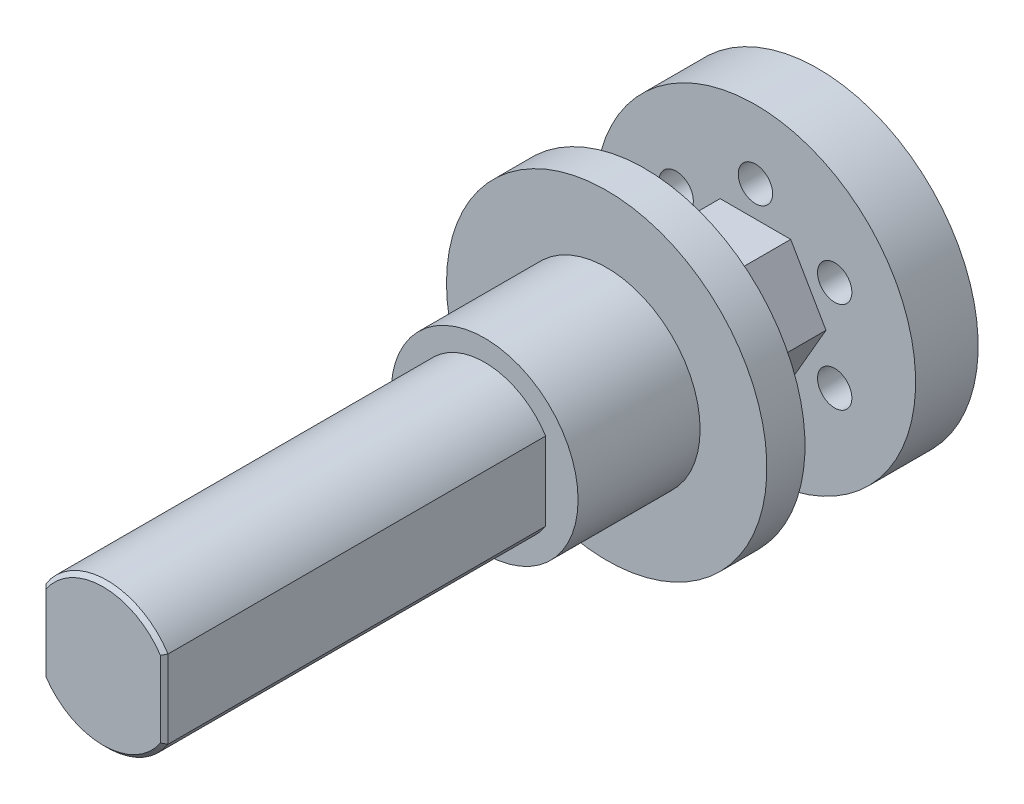
from build123d import *

# Parameters (mm, degrees)
SKETCH_1_R            = 9.25
EXTRUDE_1_DEPTH       = 89.5
SKETCH_4_R            = 12.25
EXTRUDE_2_DEPTH       = 16
SKETCH_5_R            = 21
EXTRUDE_3_DEPTH       = 5
EXTRUDE_4_DEPTH       = 4.2
EXTRUDE_4_DEPTH_BACK  = 4
SKETCH_6_R            = 21
SKETCH_6_R_2          = 2.25
SKETCH_7_R            = 20
CUT_EXTRUDE_1_DEPTH   = 2
SKETCH_8_OUTSIDE_W    = 66.188
SKETCH_8_OUTSIDE_H    = 66.188
CUT_EXTRUDE_4_DEPTH   = 14.5
SKETCH_11_R           = 9.5
EXTRUDE_5_DEPTH       = 50
SKETCH_13_W           = 10
SKETCH_13_H           = 10.246950766
CUT_EXTRUDE_1_2_DEPTH = 50
CHAMFER_1_SIZE        = 0.5


with BuildPart() as part:
    # 草图1 → 凸台-拉伸1 (new body)
    with BuildSketch(Plane.XY):
        with Locations(Location((0, 0, 0), (0, 0, 180))):
            Circle(SKETCH_1_R)
    extrude(amount=EXTRUDE_1_DEPTH)

    # 草图4 → 凸台-拉伸2 (add)
    with BuildSketch(Plane.XY.offset(39.5)):
        Circle(SKETCH_4_R)
    extrude(amount=-EXTRUDE_2_DEPTH)

    # 草图5 → 凸台-拉伸3 (add)
    with BuildSketch(Plane(origin=(0, 0, 23.5), x_dir=(-1, 0, 0), z_dir=(0, 0, -1))):
        Circle(SKETCH_5_R)
    extrude(amount=EXTRUDE_3_DEPTH)

    # 草图6 → 凸台-拉伸4 (add, two sides: drawn at the far end of the back side and taken through both)
    with BuildSketch(Plane(origin=(0, 0, 0), x_dir=(-1, 0, 0), z_dir=(0, 0, -1)).offset(-EXTRUDE_4_DEPTH_BACK)):
        Circle(SKETCH_6_R)
        with Locations((0, 12)):
            Circle(SKETCH_6_R_2, mode=Mode.SUBTRACT)
        with Locations((10.392304845, 6)):
            Circle(SKETCH_6_R_2, mode=Mode.SUBTRACT)
        with Locations((10.392304845, -6)):
            Circle(SKETCH_6_R_2, mode=Mode.SUBTRACT)
        with Locations((0, -12)):
            Circle(SKETCH_6_R_2, mode=Mode.SUBTRACT)
        with Locations((-10.392304845, -6)):
            Circle(SKETCH_6_R_2, mode=Mode.SUBTRACT)
        with Locations((-10.392304845, 6)):
            Circle(SKETCH_6_R_2, mode=Mode.SUBTRACT)
    extrude(amount=EXTRUDE_4_DEPTH + EXTRUDE_4_DEPTH_BACK)

    # 草图7 → Cut-Extrude 1 (cut)
    with BuildSketch(Plane(origin=(0, 0, -4.2), x_dir=(-1, 0, 0), z_dir=(0, 0, -1))):
        Circle(SKETCH_7_R)
    extrude(amount=-CUT_EXTRUDE_1_DEPTH, mode=Mode.SUBTRACT)

    # 草图8 outside → 切除-拉伸4 (cut)
    with BuildSketch(Plane(origin=(0, 0, 18.5), x_dir=(-1, 0, 0), z_dir=(0, 0, -1))):
        Rectangle(SKETCH_8_OUTSIDE_W, SKETCH_8_OUTSIDE_H)
        Polygon((-9.25, 0), (-4.625, -8.010734985), (4.625, -8.010734985), (9.25, 0), (4.625, 8.010734985), (-4.625, 8.010734985), align=None, mode=Mode.SUBTRACT)
    extrude(amount=CUT_EXTRUDE_4_DEPTH, mode=Mode.SUBTRACT)

    # 草图11 → 凸台-拉伸5 (add)
    with BuildSketch(Plane.XY.offset(39.5)):
        Circle(SKETCH_11_R)
    extrude(amount=EXTRUDE_5_DEPTH)

    # 草图13 → Cut-Extrude 1 2 (cut)
    with BuildSketch(Plane.XY.offset(89.5)):
        with Locations((-13, 0)):
            Rectangle(SKETCH_13_W, SKETCH_13_H)
        with Locations((13, 0)):
            Rectangle(SKETCH_13_W, SKETCH_13_H)
    extrude(amount=-CUT_EXTRUDE_1_2_DEPTH, mode=Mode.SUBTRACT)

    # 倒角1
    chamfer_1_edges = [part.edges().sort_by_distance(p)[0] for p in [
        (8, 0, 89.5),
        (0, -9.5, 89.5),
        (-8, 0, 89.5),
        (0, 9.5, 89.5),
    ]]
    chamfer(chamfer_1_edges, length=CHAMFER_1_SIZE)


solid = part.part
